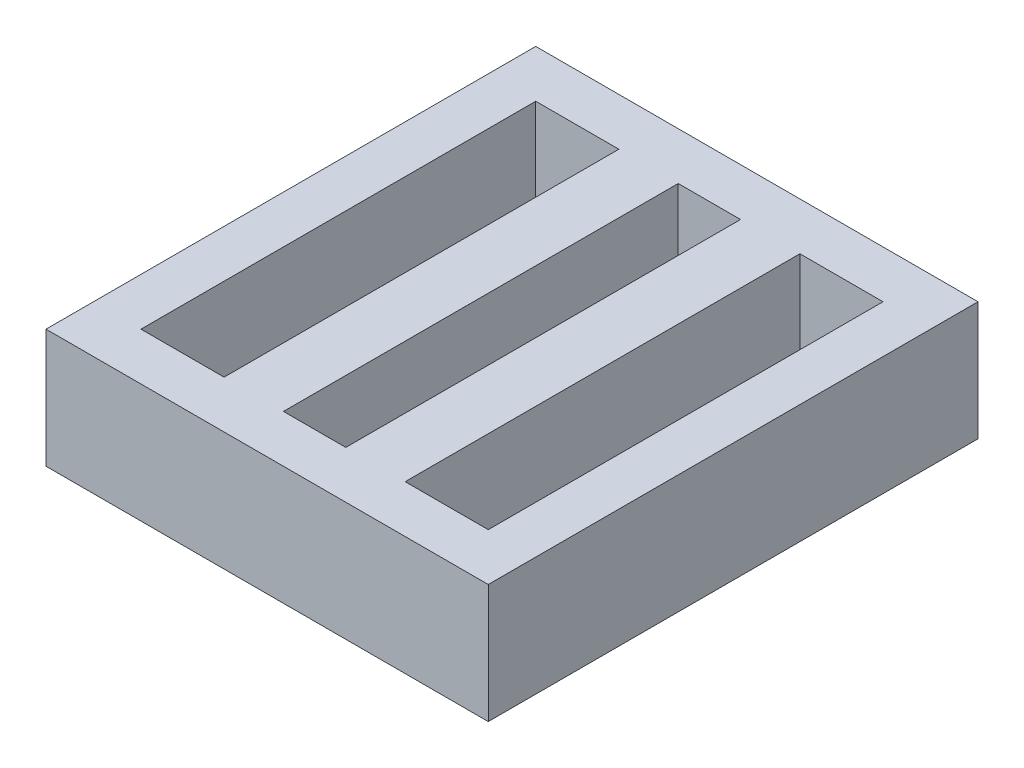
from build123d import *

# Parameters (mm, degrees)
SKETCH1_W           = 745
SKETCH1_H           = 825
SKETCH1_W_2         = 140
SKETCH1_H_2         = 665
SKETCH1_W_3         = 105
BOSS_EXTRUDE1_DEPTH = 200


with BuildPart() as part:
    # Sketch1 → Boss-Extrude1 (new body)
    with BuildSketch(Plane(origin=(0, 0, 0), x_dir=(1, 0, 0), z_dir=(0, 1, 0))):
        Rectangle(SKETCH1_W, SKETCH1_H)
        with Locations((-222.5, 0)):
            Rectangle(SKETCH1_W_2, SKETCH1_H_2, mode=Mode.SUBTRACT)
        with Locations((222.5, 0)):
            Rectangle(SKETCH1_W_2, SKETCH1_H_2, mode=Mode.SUBTRACT)
        Rectangle(SKETCH1_W_3, SKETCH1_H_2, mode=Mode.SUBTRACT)
    extrude(amount=BOSS_EXTRUDE1_DEPTH)


solid = part.part
